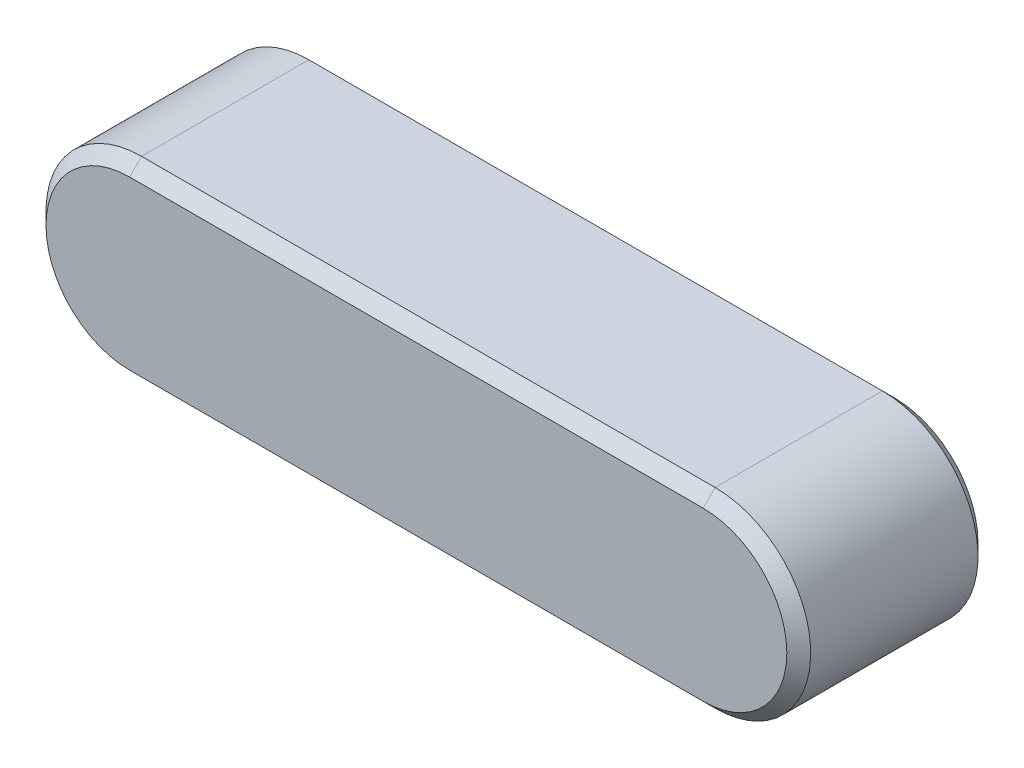
from build123d import *

# Parameters (mm, degrees)
BASEKEY_DEPTH = 2
CHAMFER1_SIZE = 0.25


with BuildPart() as part:
    # Sketch1 → BaseKey (new, symmetric)
    with BuildSketch(Plane.XY):
        with BuildLine():
            Line((-12, 2), (0, 2))
            ThreePointArc((0, 2), (2, 0), (0, -2))
            Line((0, -2), (-12, -2))
            ThreePointArc((-12, -2), (-14, 0), (-12, 2))
        make_face()
    extrude(amount=BASEKEY_DEPTH, both=True)

    # Chamfer1
    chamfer1_edges = [part.edges().sort_by_distance(p)[0] for p in [
        (2, 0, 2),
        (-6, 2, 2),
        (-14, 0, 2),
        (-6, 2, -2),
        (2, 0, -2),
        (-6, -2, -2),
        (-14, 0, -2),
        (-6, -2, 2),
    ]]
    chamfer(chamfer1_edges, length=CHAMFER1_SIZE)


solid = part.part
